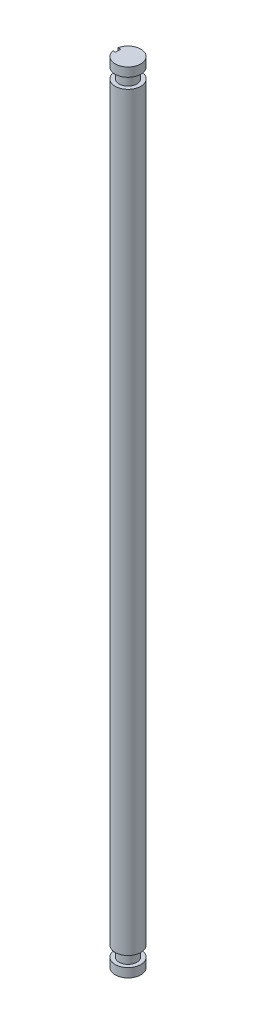
from build123d import *

# Parameters (mm, degrees)
CUT_EXTRUDE2_START = -998.728
SKETCH2_W          = 63.4619
SKETCH2_H          = 12.7
CUT_EXTRUDE2_DEPTH = 1997.456


with BuildPart() as part:
    # Sketch1 → Revolve1 (revolve)
    with BuildSketch(Plane(origin=(0, 0, 0), x_dir=(0, 1, 0), z_dir=(0, 0, 1)), mode=Mode.PRIVATE) as revolve1_sk:
        Polygon((-976.376, 0), (-976.376, 31.73095), (-954.024, 31.73095), (-954.024, 22.0218), (-928.2176, 22.0218), (-928.2176, 31.73095), (928.3446, 31.73095), (928.3446, 22.0218), (954.151, 22.0218), (954.151, 31.73095), (976.376, 31.73095), (976.376, 0), align=None)
    revolve(revolve1_sk.sketch.rotate(Axis((0, -1001.776, 0), (0, 1, 0)), 270), axis=Axis((0, -1001.776, 0), (0, 1, 0)))

    # Sketch2 → Cut-Extrude2 (cut)
    with BuildSketch(Plane(origin=(0, 0, 0), x_dir=(-1, 0, 0), z_dir=(0, 1, 0)).offset(CUT_EXTRUDE2_START)):
        with Locations((56.3372, 0)):
            Rectangle(SKETCH2_W, SKETCH2_H)
    extrude(amount=CUT_EXTRUDE2_DEPTH, mode=Mode.SUBTRACT)


solid = part.part
